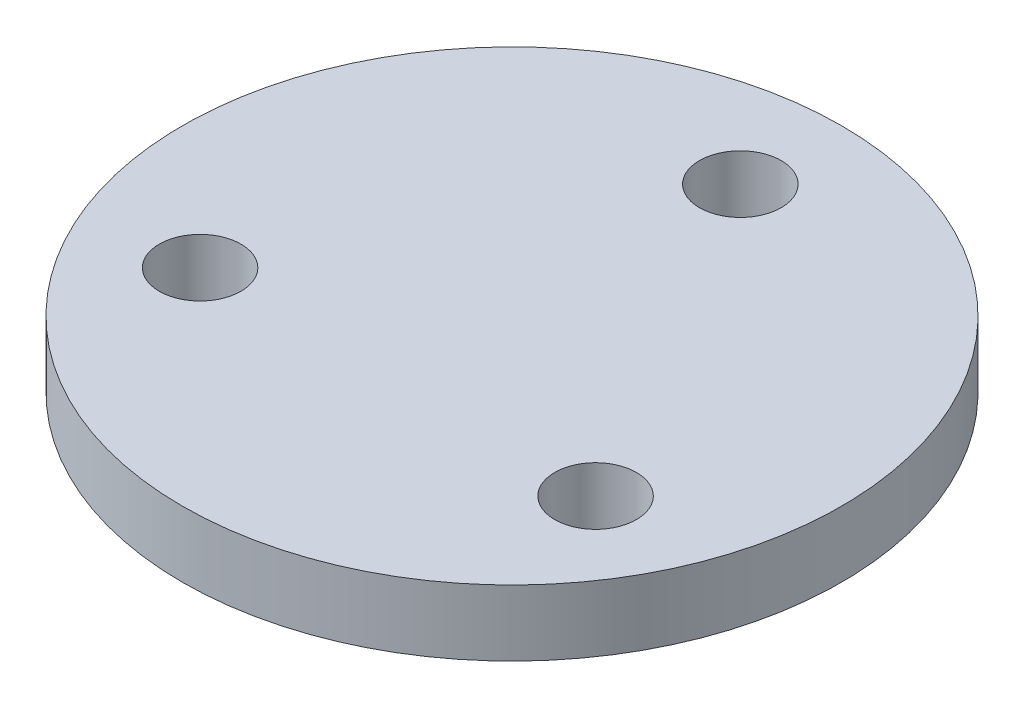
from build123d import *

# Parameters (mm, degrees)
SKETCH1_R           = 31.75
SKETCH1_R_2         = 3.937
BOSS_EXTRUDE1_DEPTH = 6.35


with BuildPart() as part:
    # Sketch1 → Boss-Extrude1 (new body)
    with BuildSketch(Plane(origin=(0, 0, 0), x_dir=(1, 0, 0), z_dir=(0, 1, 0))):
        with Locations(Location((0, 0, 0), (0, 0, 270))):
            Circle(SKETCH1_R)
        with Locations(Location((0, 21.997045256, 0), (0, 0, 270))):
            Circle(SKETCH1_R_2, mode=Mode.SUBTRACT)
        with Locations(Location((19.05, -10.998522628, 0), (0, 0, 270))):
            Circle(SKETCH1_R_2, mode=Mode.SUBTRACT)
        with Locations(Location((-19.05, -10.998522628, 0), (0, 0, 270))):
            Circle(SKETCH1_R_2, mode=Mode.SUBTRACT)
    extrude(amount=BOSS_EXTRUDE1_DEPTH)


solid = part.part
